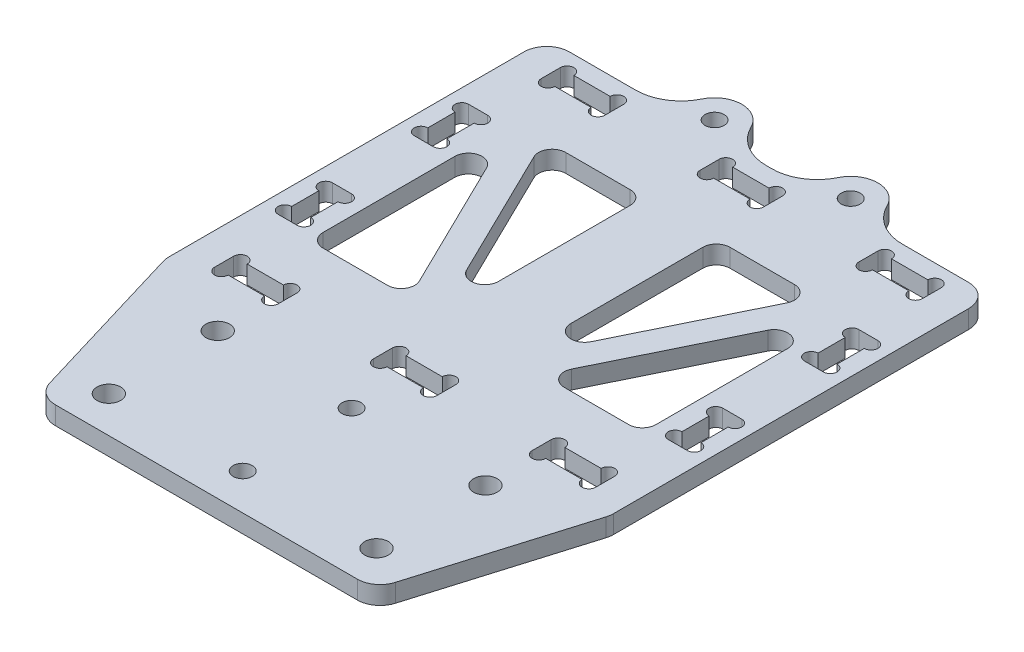
from build123d import *

# Parameters (mm, degrees)
EXTRUDE_1_DEPTH     = 4
SKETCH_2_R          = 2.6
SKETCH_2_R_2        = 2.1
CUT_EXTRUDE_1_DEPTH = 4
SKETCH_3_R          = 1.5
SKETCH_3_W          = 14
SKETCH_3_H          = 4.2
CUT_EXTRUDE_2_DEPTH = 4
EXTRUDE_2_DEPTH     = 4
SKETCH_5_R          = 6
SKETCH_5_R_2        = 2.1
EXTRUDE_3_DEPTH     = 4
FILLET_1_R          = 10
SKETCH_6_R          = 1.5
SKETCH_6_W          = 4.2
SKETCH_6_H          = 12
CUT_EXTRUDE_3_DEPTH = 10
CUT_EXTRUDE_4_DEPTH = 5
FILLET_3_R          = 3
FILLET_4_R          = 5


with BuildPart() as part:
    # 草图1 → 凸台-拉伸1 (new body)
    with BuildSketch(Plane(origin=(0, 0, 0), x_dir=(1, 0, 0), z_dir=(0, 1, 0))):
        Polygon((-37, 0), (37, 0), (37, 40), (49, 40), (49, 124), (-49, 124), (-49, 40), (-37, 40), align=None)
    extrude(amount=EXTRUDE_1_DEPTH)

    # 草图2 → 切除-拉伸1 (cut)
    with BuildSketch(Plane(origin=(0, 4, 0), x_dir=(1, 0, 0), z_dir=(0, 1, 0))):
        with Locations(Location((29.5, 8, 0), (0, 0, 270))):
            Circle(SKETCH_2_R)
        with Locations(Location((-29.5, 8, 0), (0, 0, 270))):
            Circle(SKETCH_2_R)
        with Locations(Location((29.5, 32, 0), (0, 0, 90))):
            Circle(SKETCH_2_R)
        with Locations(Location((-29.5, 32, 0), (0, 0, 90))):
            Circle(SKETCH_2_R)
        with Locations(Location((0, 32, 0), (0, 0, 270))):
            Circle(SKETCH_2_R_2)
        with Locations(Location((0, 8, 0), (0, 0, 270))):
            Circle(SKETCH_2_R_2)
    extrude(amount=-CUT_EXTRUDE_1_DEPTH, mode=Mode.SUBTRACT)

    # 草图3 → 切除-拉伸2 (cut)
    with BuildSketch(Plane(origin=(0, 4, 0), x_dir=(1, 0, 0), z_dir=(0, 1, 0))):
        with Locations((-5.5, 120)):
            Circle(SKETCH_3_R)
        with Locations((-5.5, 115.8)):
            Circle(SKETCH_3_R)
        with Locations((5.5, 120)):
            Circle(SKETCH_3_R)
        with Locations((5.5, 115.8)):
            Circle(SKETCH_3_R)
        with Locations((29.5, 115.8)):
            Circle(SKETCH_3_R)
        with Locations((29.5, 120)):
            Circle(SKETCH_3_R)
        with Locations((40.5, 120)):
            Circle(SKETCH_3_R)
        with Locations((40.5, 115.8)):
            Circle(SKETCH_3_R)
        with Locations((-40.5, 115.8)):
            Circle(SKETCH_3_R)
        with Locations((-40.5, 120)):
            Circle(SKETCH_3_R)
        with Locations((-29.5, 120)):
            Circle(SKETCH_3_R)
        with Locations((-29.5, 115.8)):
            Circle(SKETCH_3_R)
        with Locations((-29.5, 48)):
            Circle(SKETCH_3_R)
        with Locations((-29.5, 43.8)):
            Circle(SKETCH_3_R)
        with Locations((-40.5, 43.8)):
            Circle(SKETCH_3_R)
        with Locations((-40.5, 48)):
            Circle(SKETCH_3_R)
        with Locations((40.5, 48)):
            Circle(SKETCH_3_R)
        with Locations((40.5, 43.8)):
            Circle(SKETCH_3_R)
        with Locations((29.5, 43.8)):
            Circle(SKETCH_3_R)
        with Locations((29.5, 48)):
            Circle(SKETCH_3_R)
        with Locations((5.5, 48)):
            Circle(SKETCH_3_R)
        with Locations((5.5, 43.8)):
            Circle(SKETCH_3_R)
        with Locations((-5.5, 48)):
            Circle(SKETCH_3_R)
        with Locations((-5.5, 43.8)):
            Circle(SKETCH_3_R)
        with Locations((0, 117.9)):
            Rectangle(SKETCH_3_W, SKETCH_3_H)
        with Locations((35, 117.9)):
            Rectangle(SKETCH_3_W, SKETCH_3_H)
        with Locations((-35, 117.9)):
            Rectangle(SKETCH_3_W, SKETCH_3_H)
        with Locations((-35, 45.9)):
            Rectangle(SKETCH_3_W, SKETCH_3_H)
        with Locations((35, 45.9)):
            Rectangle(SKETCH_3_W, SKETCH_3_H)
        with Locations((0, 45.9)):
            Rectangle(SKETCH_3_W, SKETCH_3_H)
    extrude(amount=-CUT_EXTRUDE_2_DEPTH, mode=Mode.SUBTRACT)

    # 草图4 → 凸台-拉伸2 (add)
    with BuildSketch(Plane(origin=(0, 4, 0), x_dir=(1, 0, 0), z_dir=(0, 1, 0))):
        Polygon((-49, 40), (-37, 0), (-37, 40), align=None)
        Polygon((49, 40), (37, 0), (37, 40), align=None)
    extrude(amount=-EXTRUDE_2_DEPTH)

    # 草图5 → 凸台-拉伸3 (add)
    # profile 1 of 2: a face of its own
    with BuildSketch(Plane(origin=(0, 4, 0), x_dir=(1, 0, 0), z_dir=(0, 1, 0))):
        with Locations((-15, 127)):
            Circle(SKETCH_5_R)
        with Locations(Location((-15, 127, 0), (0, 0, 270))):
            Circle(SKETCH_5_R_2, mode=Mode.SUBTRACT)
    # profile 2 of 2: a face of its own
    with BuildSketch(Plane(origin=(0, 4, 0), x_dir=(1, 0, 0), z_dir=(0, 1, 0))):
        with Locations((15, 127)):
            Circle(SKETCH_5_R)
        with Locations(Location((15, 127, 0), (0, 0, 270))):
            Circle(SKETCH_5_R_2, mode=Mode.SUBTRACT)
    extrude(amount=-EXTRUDE_3_DEPTH)

    # 圆角1
    fillet_1_edges = [part.edges().sort_by_distance(p)[0] for p in [
        (9.803847577, 2, -124),
        (20.196152423, 2, -124),
        (-20.196152423, 2, -124),
        (-9.803847577, 2, -124),
    ]]
    fillet(fillet_1_edges, radius=FILLET_1_R)

    # 草图6 → 切除-拉伸3 (cut)
    with BuildSketch(Plane(origin=(0, 4, 0), x_dir=(1, 0, 0), z_dir=(0, 1, 0))):
        with BuildLine():
            ThreePointArc((40.9, 63.9), (39.4, 62.4), (40.9, 60.9))
            Line((40.9, 60.9), (40.9, 63.9))
        make_face()
        with BuildLine():
            Line((40.9, 63.9), (40.9, 60.9))
            ThreePointArc((40.9, 60.9), (41.960660172, 61.339339828), (42.4, 62.4))
            ThreePointArc((42.4, 62.4), (41.960660172, 63.460660172), (40.9, 63.9))
        make_face()
        with Locations((45.1, 62.4)):
            Circle(SKETCH_6_R)
        with Locations((45.1, 71.4)):
            Circle(SKETCH_6_R)
        with Locations((40.9, 71.4)):
            Circle(SKETCH_6_R)
        with Locations((40.9, 62.4)):
            Circle(SKETCH_6_R)
        with Locations((43, 66.9)):
            Rectangle(SKETCH_6_W, SKETCH_6_H)
        with BuildLine():
            ThreePointArc((45.1, 63.9), (43.6, 62.4), (45.1, 60.9))
            Line((45.1, 60.9), (45.1, 63.9))
        make_face()
        with BuildLine():
            Line((45.1, 63.9), (45.1, 60.9))
            ThreePointArc((45.1, 60.9), (46.160660172, 61.339339828), (46.6, 62.4))
            ThreePointArc((46.6, 62.4), (46.160660172, 63.460660172), (45.1, 63.9))
        make_face()
        with BuildLine():
            ThreePointArc((45.1, 72.9), (43.6, 71.4), (45.1, 69.9))
            Line((45.1, 69.9), (45.1, 72.9))
        make_face()
        with BuildLine():
            Line((45.1, 72.9), (45.1, 69.9))
            ThreePointArc((45.1, 69.9), (46.160660172, 70.339339828), (46.6, 71.4))
            ThreePointArc((46.6, 71.4), (46.160660172, 72.460660172), (45.1, 72.9))
        make_face()
        with BuildLine():
            ThreePointArc((40.9, 72.9), (39.4, 71.4), (40.9, 69.9))
            Line((40.9, 69.9), (40.9, 72.9))
        make_face()
        with BuildLine():
            Line((40.9, 72.9), (40.9, 69.9))
            ThreePointArc((40.9, 69.9), (41.960660172, 70.339339828), (42.4, 71.4))
            ThreePointArc((42.4, 71.4), (41.960660172, 72.460660172), (40.9, 72.9))
        make_face()
        with BuildLine():
            ThreePointArc((42.4, 92.4), (41.960660172, 93.460660172), (40.9, 93.9))
            Line((40.9, 93.9), (40.9, 90.9))
            ThreePointArc((40.9, 90.9), (41.960660172, 91.339339828), (42.4, 92.4))
        make_face()
        with BuildLine():
            Line((40.9, 90.9), (40.9, 93.9))
            ThreePointArc((40.9, 93.9), (39.4, 92.4), (40.9, 90.9))
        make_face()
        with BuildLine():
            ThreePointArc((42.4, 101.4), (41.960660172, 102.460660172), (40.9, 102.9))
            Line((40.9, 102.9), (40.9, 99.9))
            ThreePointArc((40.9, 99.9), (41.960660172, 100.339339828), (42.4, 101.4))
        make_face()
        with BuildLine():
            Line((40.9, 99.9), (40.9, 102.9))
            ThreePointArc((40.9, 102.9), (39.4, 101.4), (40.9, 99.9))
        make_face()
        with Locations((45.1, 92.4)):
            Circle(SKETCH_6_R)
        with Locations((45.1, 101.4)):
            Circle(SKETCH_6_R)
        with Locations((40.9, 101.4)):
            Circle(SKETCH_6_R)
        with Locations((40.9, 92.4)):
            Circle(SKETCH_6_R)
        with Locations((43, 96.9)):
            Rectangle(SKETCH_6_W, SKETCH_6_H)
        with BuildLine():
            ThreePointArc((46.6, 92.4), (46.160660172, 93.460660172), (45.1, 93.9))
            Line((45.1, 93.9), (45.1, 90.9))
            ThreePointArc((45.1, 90.9), (46.160660172, 91.339339828), (46.6, 92.4))
        make_face()
        with BuildLine():
            Line((45.1, 90.9), (45.1, 93.9))
            ThreePointArc((45.1, 93.9), (43.6, 92.4), (45.1, 90.9))
        make_face()
        with BuildLine():
            ThreePointArc((46.6, 101.4), (46.160660172, 102.460660172), (45.1, 102.9))
            Line((45.1, 102.9), (45.1, 99.9))
            ThreePointArc((45.1, 99.9), (46.160660172, 100.339339828), (46.6, 101.4))
        make_face()
        with BuildLine():
            Line((45.1, 99.9), (45.1, 102.9))
            ThreePointArc((45.1, 102.9), (43.6, 101.4), (45.1, 99.9))
        make_face()
    cut_extrude_3 = extrude(amount=-CUT_EXTRUDE_3_DEPTH, mode=Mode.SUBTRACT)

    # 草图7 → 切除-拉伸4 (cut)
    with BuildSketch(Plane(origin=(0, 4, 0), x_dir=(1, 0, 0), z_dir=(0, 1, 0))):
        Polygon((-36.678655886, 104.4), (-36.678655886, 59.4), (-14.678655886, 59.4), align=None)
        Polygon((-30, 104.4), (-8, 59.4), (-8, 104.4), align=None)
        Polygon((8, 104.4), (30, 104.4), (8, 59.4), align=None)
        Polygon((14.678655886, 59.4), (36.678655886, 104.4), (36.678655886, 59.4), align=None)
    extrude(amount=-CUT_EXTRUDE_4_DEPTH, mode=Mode.SUBTRACT)

    # 圆角3
    fillet_3_edges = [part.edges().sort_by_distance(p)[0] for p in [
        (-30, 2, -104.4),
        (-8, 2, -104.4),
        (-8, 2, -59.4),
        (8, 2, -59.4),
        (8, 2, -104.4),
        (30, 2, -104.4),
        (36.678655886, 2, -59.4),
        (14.678655886, 2, -59.4),
        (36.678655886, 2, -104.4),
        (-36.678655886, 2, -104.4),
        (-14.678655886, 2, -59.4),
        (-36.678655886, 2, -59.4),
    ]]
    fillet(fillet_3_edges, radius=FILLET_3_R)

    # 镜向1: 切除-拉伸3 across plane
    add(cut_extrude_3.mirror(Plane(origin=(0, 0, 0), x_dir=(0, 0, 1), z_dir=(1, 0, 0))), mode=Mode.SUBTRACT)

    # 圆角4
    fillet_4_edges = [part.edges().sort_by_distance(p)[0] for p in [
        (37, 2, 0),
        (-37, 2, 0),
        (-49, 2, -40),
        (-49, 2, -124),
        (49, 2, -124),
        (49, 2, -40),
    ]]
    fillet(fillet_4_edges, radius=FILLET_4_R)


solid = part.part
